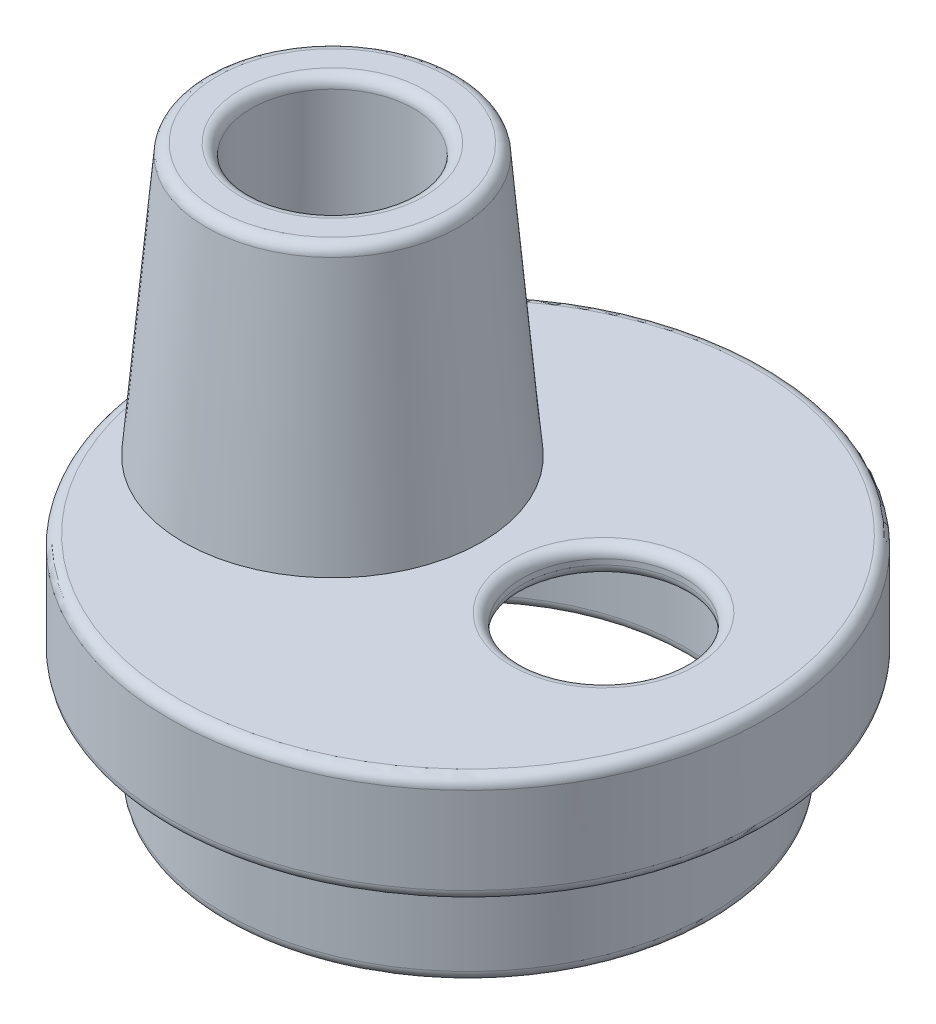
from build123d import *

# Parameters (mm, degrees)
CUT_EXTRUDE1_REACH  = 10.746
SKETCH2_R           = 1.5
BOSS_EXTRUDE1_START = 5
SKETCH3_R           = 2.75
SKETCH3_R_2         = 1.5
BOSS_EXTRUDE1_DEPTH = 5
DRAFT2_ANGLE        = 5
FILLET1_R           = 0.2


with BuildPart() as part:
    # Sketch1 → Revolve1 (revolve)
    with BuildSketch(Plane(origin=(0, 0, 0), x_dir=(0, 0, -1), z_dir=(1, 0, 0))):
        Polygon((-5.5, -2), (-4.5, -2), (-4.5, -4), (-4, -4), (-4, -1.5), (-5, -1.5), (-5, -0.5), (0, -0.5), (0, 0), (-5.5, 0), align=None)
    revolve(axis=Axis((0, 0, 0), (0, -1, 0)))

    # Sketch2 → Cut-Extrude1 (cut, up to next)
    with BuildSketch(Plane(origin=(0, 0, 0), x_dir=(1, 0, 0), z_dir=(0, 1, 0)), mode=Mode.PRIVATE) as cut_extrude1_sk1:
        with Locations(Location((2.5, 0, 0), (0, 0, 270))):
            Circle(SKETCH2_R)
    cut_extrude1_tool1 = extrude(cut_extrude1_sk1.sketch, amount=-CUT_EXTRUDE1_REACH, mode=Mode.PRIVATE) & part.part
    # Sketch2 → Cut-Extrude1 (cut, up to next)
    with BuildSketch(Plane(origin=(0, 0, 0), x_dir=(1, 0, 0), z_dir=(0, 1, 0)), mode=Mode.PRIVATE) as cut_extrude1_sk2:
        with Locations(Location((-2.5, 0, 0), (0, 0, 90))):
            Circle(SKETCH2_R)
    cut_extrude1_tool2 = extrude(cut_extrude1_sk2.sketch, amount=-CUT_EXTRUDE1_REACH, mode=Mode.PRIVATE) & part.part
    add(cut_extrude1_tool1.solids().sort_by_distance((2.5, 0, 0))[0], mode=Mode.SUBTRACT)
    add(cut_extrude1_tool2.solids().sort_by_distance((-2.5, 0, 0))[0], mode=Mode.SUBTRACT)

    # Sketch3 → Boss-Extrude1 (add)
    with BuildSketch(Plane(origin=(0, 0, 0), x_dir=(1, 0, 0), z_dir=(0, 1, 0)).offset(BOSS_EXTRUDE1_START)):
        with Locations(Location((-2.5, 0, 0), (0, 0, 270))):
            Circle(SKETCH3_R)
        with Locations(Location((-2.5, 0, 0), (0, 0, 270))):
            Circle(SKETCH3_R_2, mode=Mode.SUBTRACT)
    extrude(amount=-BOSS_EXTRUDE1_DEPTH)

    # Draft2
    draft2_faces = [part.faces().sort_by_distance(p)[0] for p in [
        (-2.5, 2.5, -2.75),
    ]]
    draft(draft2_faces, Plane.ZX, DRAFT2_ANGLE)

    # Fillet1
    fillet1_edges = [part.edges().sort_by_distance(p)[0] for p in [
        (0, -2, -5.5),
        (0, 0, -5.5),
        (2.5, -0.5, -1.5),
        (2.5, 0, -1.5),
        (-2.5, -0.5, 1.5),
        (-2.5, 5, -2.312556682),
        (-2.5, 5, -1.5),
        (0, -4, -4),
        (0, -4, -4.5),
    ]]
    fillet(fillet1_edges, radius=FILLET1_R)


solid = part.part
